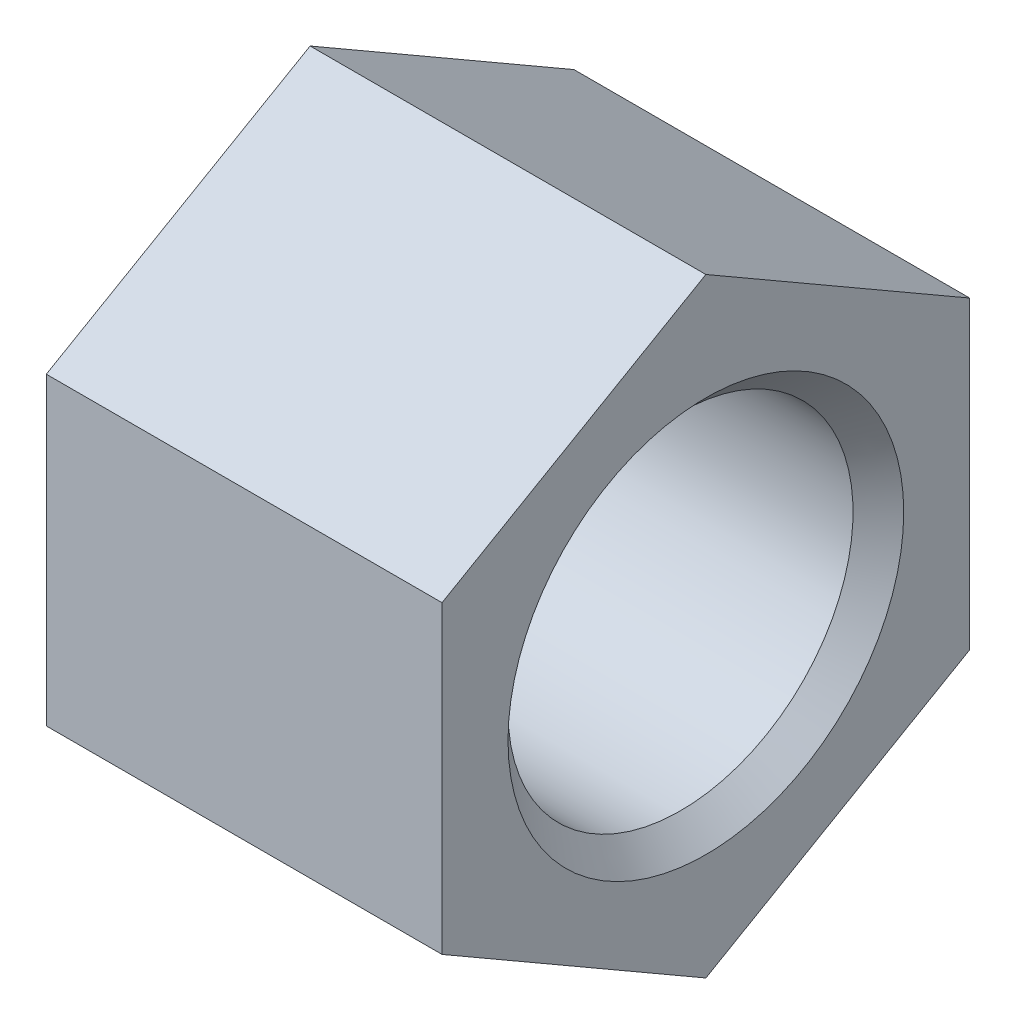
from build123d import *

# Parameters (mm, degrees)
CHAMFER_1_SIZE  = 1.921
EXTRUDE_START   = -30
SKETCH_2_R      = 19.5
EXTRUDE_1_DEPTH = 30


with BuildPart() as part:
    # Эскиз1 → Повернуть1 (revolve)
    with BuildSketch(Plane.XY, mode=Mode.PRIVATE) as revolve_1_sk:
        Polygon((0, 6.5), (5, 6.5), (5, 15), (10, 15), (10, 13.079), (30, 13.079), (30, 19.5), (0, 19.5), align=None)
    revolve(revolve_1_sk.sketch.rotate(Axis((0, 0, 0), (1, 0, 0)), 90), axis=Axis((0, 0, 0), (1, 0, 0)))

    # Фаска1
    chamfer_1_edges = [part.edges().sort_by_distance(p)[0] for p in [
        (30, 0, -13.079),
    ]]
    chamfer(chamfer_1_edges, length=CHAMFER_1_SIZE)

    # Эскиз2 → Бобышка-Вытянуть1 (add)
    with BuildSketch(Plane(origin=(30, 0, 0), x_dir=(0, 0, -1), z_dir=(1, 0, 0)).offset(EXTRUDE_START)):
        Polygon((0, 23.094010768), (-20, 11.547005384), (-20, -11.547005384), (0, -23.094010768), (20, -11.547005384), (20, 11.547005384), align=None)
        Circle(SKETCH_2_R, mode=Mode.SUBTRACT)
    extrude(amount=EXTRUDE_1_DEPTH)


solid = part.part
